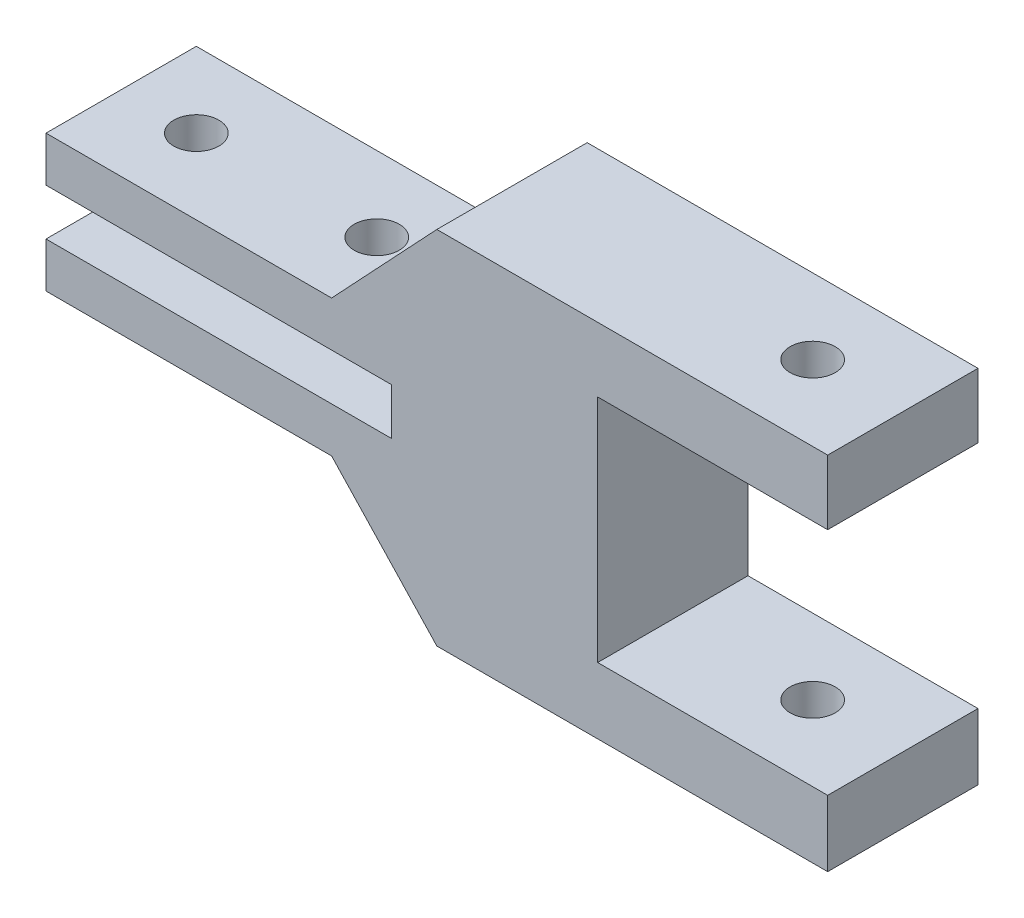
from build123d import *

# Parameters (mm, degrees)
EXTRUDE_1_DEPTH     = 10
CUT_EXTRUDE_5_REACH = 34.402
SKETCH_7_R          = 1.5
SKETCH_8_W          = 15.3
SKETCH_8_H          = 15.3
CUT_EXTRUDE_6_DEPTH = 10
SKETCH_11_R         = 1.5
CUT_EXTRUDE_8_DEPTH = 37.769552622


with BuildPart() as part:
    # 草图1 → 凸台-拉伸1 (new body)
    with BuildSketch(Plane.XY):
        Polygon((-26, 4.55), (-26, 1.55), (-3, 1.55), (-3, -1.55), (-26, -1.55), (-26, -4.55), (-7, -4.55), (0, -12), (26, -12), (26, 12), (0, 12), (-7, 4.55), align=None)
    extrude(amount=EXTRUDE_1_DEPTH)

    # 切除-拉伸5: up to this face of the body (flat: up to its plane)
    cut_extrude_5_end = Plane(part.part.faces().sort_by_distance((-16.5, -4.55, 5))[0])
    # 草图7 → 切除-拉伸5 (cut, up to the picked face)
    with BuildSketch(Plane(origin=(0, 4.55, 0), x_dir=(1, 0, 0), z_dir=(0, 1, 0)), mode=Mode.PRIVATE) as cut_extrude_5_sk1:
        with Locations(Location((-21, -5, 0), (0, 0, 270))):
            Circle(SKETCH_7_R)
    cut_extrude_5_tool1 = split(extrude(cut_extrude_5_sk1.sketch, amount=-CUT_EXTRUDE_5_REACH, mode=Mode.PRIVATE), bisect_by=cut_extrude_5_end, keep=Keep.BOTH, mode=Mode.PRIVATE)
    # 草图7 → 切除-拉伸5 (cut, up to the picked face)
    with BuildSketch(Plane(origin=(0, 4.55, 0), x_dir=(1, 0, 0), z_dir=(0, 1, 0)), mode=Mode.PRIVATE) as cut_extrude_5_sk2:
        with Locations(Location((-9, -5, 0), (0, 0, 270))):
            Circle(SKETCH_7_R)
    cut_extrude_5_tool2 = split(extrude(cut_extrude_5_sk2.sketch, amount=-CUT_EXTRUDE_5_REACH, mode=Mode.PRIVATE), bisect_by=cut_extrude_5_end, keep=Keep.BOTH, mode=Mode.PRIVATE)
    add(cut_extrude_5_tool1.solids().sort_by(Axis((-21, 4.55, 5), (0, -1, 0)))[0], mode=Mode.SUBTRACT)
    add(cut_extrude_5_tool2.solids().sort_by(Axis((-9, 4.55, 5), (0, -1, 0)))[0], mode=Mode.SUBTRACT)

    # 草图8 → 切除-拉伸6 (cut)
    with BuildSketch(Plane(origin=(0, 0, 0), x_dir=(-1, 0, 0), z_dir=(0, 0, -1))):
        with Locations((-18.35, 0.05)):
            Rectangle(SKETCH_8_W, SKETCH_8_H)
    extrude(amount=-CUT_EXTRUDE_6_DEPTH, mode=Mode.SUBTRACT)

    # 草图11 → 切除-拉伸8 (cut, through all)
    with BuildSketch(Plane.XZ.offset(12)):
        with Locations((20, 5)):
            Circle(SKETCH_11_R)
    extrude(amount=-CUT_EXTRUDE_8_DEPTH, mode=Mode.SUBTRACT)


solid = part.part
